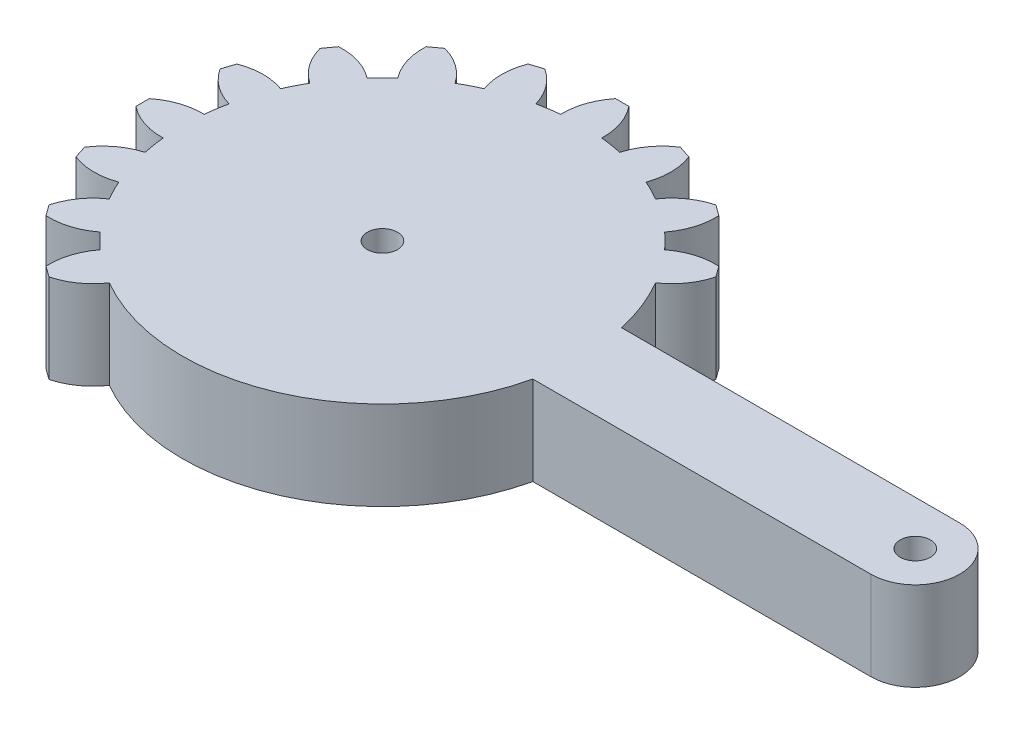
from build123d import *

# Parameters (mm, degrees)
SKETCH2_R           = 1.7
BOSS_EXTRUDE1_DEPTH = 10
BOSS_EXTRUDE2_DEPTH = 10
SKETCH3_R           = 1.7
CUT_EXTRUDE1_DEPTH  = 72.091490349


with BuildPart() as part:
    # Sketch2 → Boss-Extrude1 (new body)
    with BuildSketch(Plane(origin=(0, 0, 0), x_dir=(1, 0, 0), z_dir=(0, 1, 0))):
        with BuildLine():
            ThreePointArc((60, -5), (65, 0), (60, 5))
            Line((60, 5), (21.937410968, 5))
            ThreePointArc((21.937410968, 5), (20.937955519, 8.237233678), (19.463757806, 11.287698262))
            ThreePointArc((19.463757806, 11.287698262), (21.232218388, 13.021454794), (22.284297787, 15.263439066))
            Line((22.284297787, 15.263439066), (21.402619909, 16.476964558))
            ThreePointArc((21.402619909, 16.476964558), (18.945255744, 16.16918883), (16.749870923, 15.023043103))
            ThreePointArc((16.749870923, 15.023043103), (15.909902577, 15.909902577), (15.023043103, 16.749870923))
            ThreePointArc((15.023043103, 16.749870923), (16.16918883, 18.945255744), (16.476964558, 21.402619909))
            Line((16.476964558, 21.402619909), (15.263439066, 22.284297787))
            ThreePointArc((15.263439066, 22.284297787), (13.021454794, 21.232218388), (11.287698262, 19.463757806))
            ThreePointArc((11.287698262, 19.463757806), (10.214786244, 20.047646794), (9.111768269, 20.572449514))
            ThreePointArc((9.111768269, 20.572449514), (9.523406413, 23.014563062), (9.056751235, 25.446763194))
            Line((9.056751235, 25.446763194), (7.630166461, 25.910288686))
            ThreePointArc((7.630166461, 25.910288686), (5.823023123, 24.216890476), (4.72060705, 21.999224284))
            ThreePointArc((4.72060705, 21.999224284), (3.519775463, 22.222987663), (2.308570071, 22.381253411))
            ThreePointArc((2.308570071, 22.381253411), (1.945406622, 24.831044595), (0.75, 27))
            Line((0.75, 27), (-0.75, 27))
            ThreePointArc((-0.75, 27), (-1.945406622, 24.831044595), (-2.308570071, 22.381253411))
            ThreePointArc((-2.308570071, 22.381253411), (-3.519775463, 22.222987663), (-4.72060705, 21.999224284))
            ThreePointArc((-4.72060705, 21.999224284), (-5.823023123, 24.216890476), (-7.630166461, 25.910288686))
            Line((-7.630166461, 25.910288686), (-9.056751235, 25.446763194))
            ThreePointArc((-9.056751235, 25.446763194), (-9.523406413, 23.014563062), (-9.111768269, 20.572449514))
            ThreePointArc((-9.111768269, 20.572449514), (-10.214786244, 20.047646794), (-11.287698262, 19.463757806))
            ThreePointArc((-11.287698262, 19.463757806), (-13.021454794, 21.232218388), (-15.263439066, 22.284297787))
            Line((-15.263439066, 22.284297787), (-16.476964558, 21.402619909))
            ThreePointArc((-16.476964558, 21.402619909), (-16.16918883, 18.945255744), (-15.023043103, 16.749870923))
            ThreePointArc((-15.023043103, 16.749870923), (-15.909902577, 15.909902577), (-16.749870923, 15.023043103))
            ThreePointArc((-16.749870923, 15.023043103), (-18.945255744, 16.16918883), (-21.402619909, 16.476964558))
            Line((-21.402619909, 16.476964558), (-22.284297787, 15.263439066))
            ThreePointArc((-22.284297787, 15.263439066), (-21.232218388, 13.021454794), (-19.463757806, 11.287698262))
            ThreePointArc((-19.463757806, 11.287698262), (-20.047646794, 10.214786244), (-20.572449514, 9.111768269))
            ThreePointArc((-20.572449514, 9.111768269), (-23.014563062, 9.523406413), (-25.446763194, 9.056751235))
            Line((-25.446763194, 9.056751235), (-25.910288686, 7.630166461))
            ThreePointArc((-25.910288686, 7.630166461), (-24.216890476, 5.823023123), (-21.999224284, 4.72060705))
            ThreePointArc((-21.999224284, 4.72060705), (-22.222987663, 3.519775463), (-22.381253411, 2.308570071))
            ThreePointArc((-22.381253411, 2.308570071), (-24.831044595, 1.945406622), (-27, 0.75))
            Line((-27, 0.75), (-27, -0.75))
            ThreePointArc((-27, -0.75), (-24.831044595, -1.945406622), (-22.381253411, -2.308570071))
            ThreePointArc((-22.381253411, -2.308570071), (-22.222987663, -3.519775463), (-21.999224284, -4.72060705))
            ThreePointArc((-21.999224284, -4.72060705), (-24.216890476, -5.823023123), (-25.910288686, -7.630166461))
            Line((-25.910288686, -7.630166461), (-25.446763194, -9.056751235))
            ThreePointArc((-25.446763194, -9.056751235), (-23.014563062, -9.523406413), (-20.572449514, -9.111768269))
            ThreePointArc((-20.572449514, -9.111768269), (-20.047646794, -10.214786244), (-19.463757806, -11.287698262))
            ThreePointArc((-19.463757806, -11.287698262), (-21.232218388, -13.021454794), (-22.284297787, -15.263439066))
            Line((-22.284297787, -15.263439066), (-21.402619909, -16.476964558))
            ThreePointArc((-21.402619909, -16.476964558), (-18.945255744, -16.16918883), (-16.749870923, -15.023043103))
            ThreePointArc((-16.749870923, -15.023043103), (-15.909902577, -15.909902577), (-15.023043103, -16.749870923))
            ThreePointArc((-15.023043103, -16.749870923), (-16.16918883, -18.945255744), (-16.476964558, -21.402619909))
            Line((-16.476964558, -21.402619909), (-15.263439066, -22.284297787))
            ThreePointArc((-15.263439066, -22.284297787), (-13.021454794, -21.232218388), (-11.287698262, -19.463757806))
            ThreePointArc((-11.287698262, -19.463757806), (9.111768269, -20.572449514), (21.999224284, -4.72060705))
            ThreePointArc((21.999224284, -4.72060705), (22.395016771, -4.848633199), (22.782483518, -5))
            Line((22.782483518, -5), (60, -5))
        make_face()
        with BuildLine():
            ThreePointArc((22.381253411, 2.308570071), (24.831044595, 1.945406622), (27, 0.75))
            Line((27, 0.75), (27, -0.75))
            ThreePointArc((27, -0.75), (24.831044595, -1.945406622), (22.381253411, -2.308570071))
            ThreePointArc((22.381253411, -2.308570071), (22.5, 0), (22.381253411, 2.308570071))
        make_face(mode=Mode.SUBTRACT)
        with Locations(Location((60, 0, 0), (0, 0, 270))):
            Circle(SKETCH2_R, mode=Mode.SUBTRACT)
    extrude(amount=BOSS_EXTRUDE1_DEPTH)

    # Sketch2<7> → Boss-Extrude2 (add)
    with BuildSketch(Plane(origin=(0, 0, 0), x_dir=(1, 0, 0), z_dir=(0, 1, 0))):
        with BuildLine():
            Line((21.937410968, -5), (22.782483518, -5))
            ThreePointArc((22.782483518, -5), (22.395016771, -4.848633199), (21.999224284, -4.72060705))
            ThreePointArc((21.999224284, -4.72060705), (21.968761786, -4.860401792), (21.937410968, -5))
        make_face()
        with BuildLine():
            ThreePointArc((27, 0.75), (24.831044595, 1.945406622), (22.381253411, 2.308570071))
            ThreePointArc((22.381253411, 2.308570071), (22.5, 0), (22.381253411, -2.308570071))
            ThreePointArc((22.381253411, -2.308570071), (24.831044595, -1.945406622), (27, -0.75))
            Line((27, -0.75), (27, 0.75))
        make_face()
    extrude(amount=BOSS_EXTRUDE2_DEPTH)

    # Sketch3 → Cut-Extrude1 (cut, through all)
    with BuildSketch(Plane(origin=(0, 10, 0), x_dir=(1, 0, 0), z_dir=(0, 1, 0))):
        with Locations(Location((0, 0, 0), (0, 0, 270))):
            Circle(SKETCH3_R)
    extrude(amount=-CUT_EXTRUDE1_DEPTH, mode=Mode.SUBTRACT)


solid = part.part
